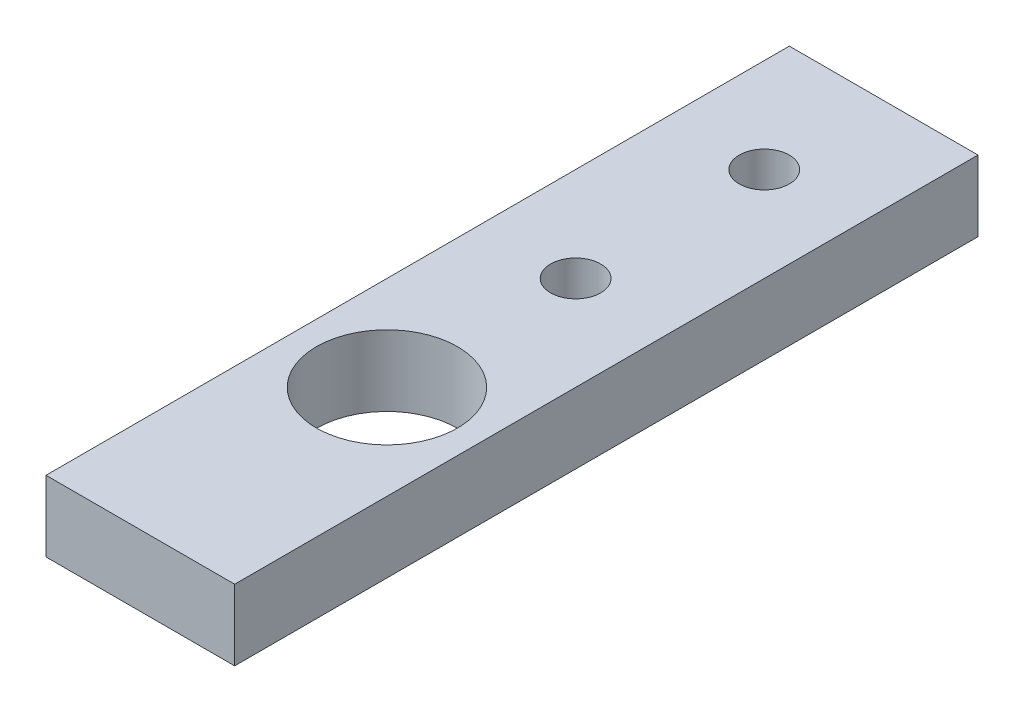
from build123d import *

# Parameters (mm, degrees)
SKETCH1_W           = 25.4
SKETCH1_H           = 9.525
BOSS_EXTRUDE1_DEPTH = 100.076
SKETCH2_R           = 3.3734375
SKETCH2_R_2         = 9.498
CUT_EXTRUDE1_DEPTH  = 102.3272984


with BuildPart() as part:
    # Sketch1 → Boss-Extrude1 (new body)
    with BuildSketch(Plane.XY):
        Rectangle(SKETCH1_W, SKETCH1_H)
    extrude(amount=BOSS_EXTRUDE1_DEPTH)

    # Sketch2 → Cut-Extrude1 (cut, through all)
    with BuildSketch(Plane(origin=(0, 4.7625, 0), x_dir=(1, 0, 0), z_dir=(0, 1, 0))):
        with Locations(Location((0, -16.0734375, 0), (0, 0, 180))):
            Circle(SKETCH2_R)
        with Locations(Location((0, -41.4734375, 0), (0, 0, 180))):
            Circle(SKETCH2_R)
        with Locations(Location((0, -66.8734375, 0), (0, 0, 180))):
            Circle(SKETCH2_R_2)
    extrude(amount=-CUT_EXTRUDE1_DEPTH, mode=Mode.SUBTRACT)


solid = part.part
